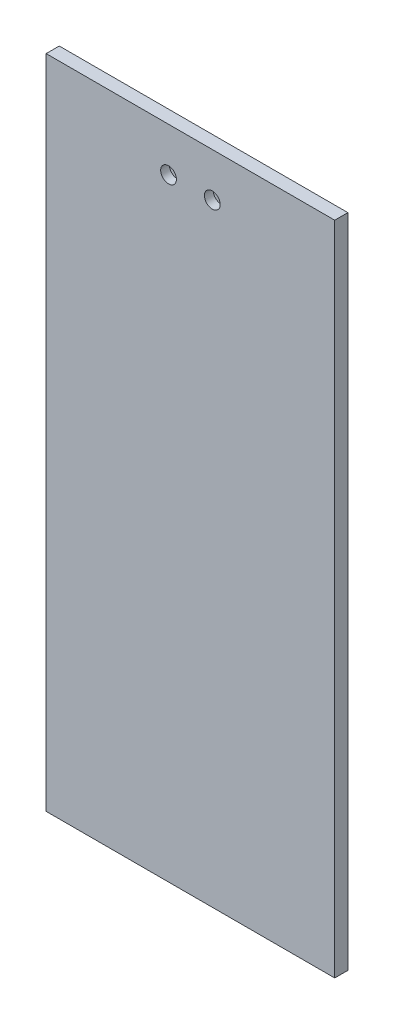
from build123d import *

# Parameters (mm, degrees)
SKETCH1_W           = 65.96
SKETCH1_H           = 3
BOSS_EXTRUDE1_DEPTH = 150
SKETCH3_R           = 1.8
CUT_EXTRUDE1_DEPTH  = 2


with BuildPart() as part:
    # Sketch1 → Boss-Extrude1 (new body)
    with BuildSketch(Plane(origin=(0, 0, 0), x_dir=(1, 0, 0), z_dir=(0, 1, 0))):
        with Locations((32.98, 1.5)):
            Rectangle(SKETCH1_W, SKETCH1_H)
    extrude(amount=BOSS_EXTRUDE1_DEPTH)

    # Sketch3 → Cut-Extrude1 (cut)
    with BuildSketch(Plane.XY):
        with Locations((27.98, 140)):
            Circle(SKETCH3_R)
        with Locations((37.98, 140)):
            Circle(SKETCH3_R)
    extrude(amount=-CUT_EXTRUDE1_DEPTH, mode=Mode.SUBTRACT)


solid = part.part
